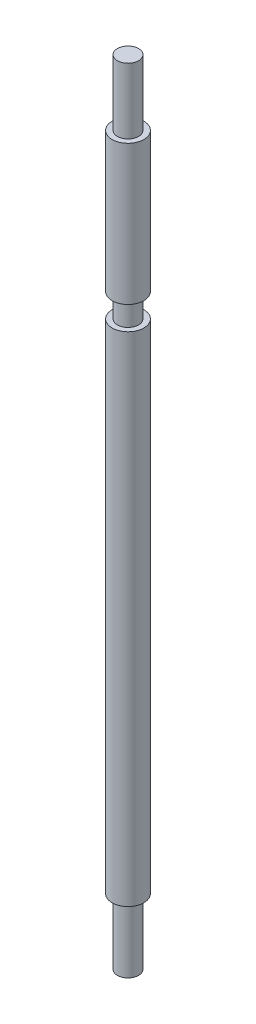
from build123d import *

# Parameters (mm, degrees)
SKETCH_1_R      = 1.5
EXTRUDE_1_DEPTH = 56.175
EXTRUDE_START   = -9.3
SKETCH_2_R      = 2.25
EXTRUDE_2_DEPTH = 70.6
EXTRUDE_START_2 = -29.1
SKETCH_3_R      = 2.25
EXTRUDE_3_DEPTH = 19.8


with BuildPart() as part:
    # 草图1 → 凸台-拉伸1 (new, symmetric)
    with BuildSketch(Plane(origin=(0, 0, 0), x_dir=(1, 0, 0), z_dir=(0, 1, 0))):
        with Locations(Location((0, 0, 0), (0, 0, 90))):
            Circle(SKETCH_1_R)
    extrude(amount=EXTRUDE_1_DEPTH, both=True)

    # 草图2 → 凸台-拉伸2 (add)
    with BuildSketch(Plane.XZ.offset(56.175).offset(EXTRUDE_START)):
        with Locations(Location((0, 0, 0), (0, 0, 270))):
            Circle(SKETCH_2_R)
    extrude(amount=-EXTRUDE_2_DEPTH)

    # 草图3 → 凸台-拉伸3 (add)
    with BuildSketch(Plane(origin=(0, 56.175, 0), x_dir=(1, 0, 0), z_dir=(0, 1, 0)).offset(EXTRUDE_START_2)):
        with Locations(Location((0, 0, 0), (0, 0, 90))):
            Circle(SKETCH_3_R)
    extrude(amount=EXTRUDE_3_DEPTH)


solid = part.part
